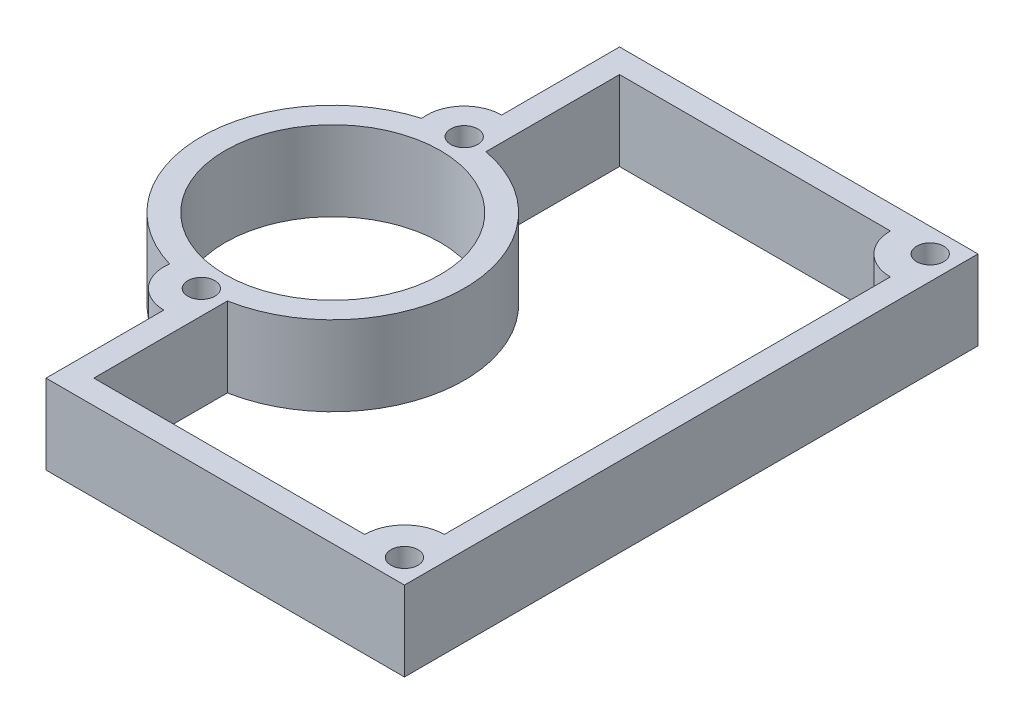
from build123d import *

# Parameters (mm, degrees)
SKETCH2_R           = 13.5
BOSS_EXTRUDE2_DEPTH = 10
CUT_EXTRUDE1_DEPTH  = 59.489315264
BOSS_EXTRUDE3_DEPTH = 10
SKETCH5_R           = 1.7
CUT_EXTRUDE3_DEPTH  = 59.489315264


with BuildPart() as part:
    # Sketch2 → Boss-Extrude2 (new body)
    # profile 1 of 4: a face of its own
    with BuildSketch(Plane(origin=(0, 0, 0), x_dir=(1, 0, 0), z_dir=(0, 1, 0))):
        with BuildLine():
            ThreePointArc((4.652086817, 15.830606061), (3.552193091, 19.577649142), (0, 21.2))
            ThreePointArc((0, 21.2), (-3.552193091, 19.577649142), (-4.652086817, 15.830606061))
            ThreePointArc((-4.652086817, 15.830606061), (-3.188214551, 16.189048396), (-1.697742762, 16.412424242))
            ThreePointArc((-1.697742762, 16.412424242), (-0.043802421, 18.199435597), (1.7, 16.5))
            ThreePointArc((1.7, 16.5), (1.699435597, 16.456197579), (1.697742762, 16.412424242))
            ThreePointArc((1.697742762, 16.412424242), (3.188214551, 16.189048396), (4.652086817, 15.830606061))
        make_face()
    # profile 2 of 4: a face of its own
    with BuildSketch(Plane(origin=(0, 0, 0), x_dir=(1, 0, 0), z_dir=(0, 1, 0))):
        with BuildLine():
            ThreePointArc((-1.697742762, 16.412424242), (-3.188214551, 16.189048396), (-4.652086817, 15.830606061))
            ThreePointArc((-4.652086817, 15.830606061), (-16.5, 0), (-4.652086817, -15.830606061))
            ThreePointArc((-4.652086817, -15.830606061), (-3.188214551, -16.189048396), (-1.697742762, -16.412424242))
            ThreePointArc((-1.697742762, -16.412424242), (0, -14.8), (1.697742762, -16.412424242))
            ThreePointArc((1.697742762, -16.412424242), (3.188214551, -16.189048396), (4.652086817, -15.830606061))
            ThreePointArc((4.652086817, -15.830606061), (16.5, 0), (4.652086817, 15.830606061))
            ThreePointArc((4.652086817, 15.830606061), (3.188214551, 16.189048396), (1.697742762, 16.412424242))
            ThreePointArc((1.697742762, 16.412424242), (0, 14.8), (-1.697742762, 16.412424242))
        make_face()
        with Locations(Location((0, 0, 0), (0, 0, 270))):
            Circle(SKETCH2_R, mode=Mode.SUBTRACT)
    # profile 3 of 4: a face of its own
    with BuildSketch(Plane(origin=(0, 0, 0), x_dir=(1, 0, 0), z_dir=(0, 1, 0))):
        with BuildLine():
            ThreePointArc((-1.697742762, -16.412424242), (-3.188214551, -16.189048396), (-4.652086817, -15.830606061))
            ThreePointArc((-4.652086817, -15.830606061), (-3.552193091, -19.577649142), (0, -21.2))
            ThreePointArc((0, -21.2), (3.552193091, -19.577649142), (4.652086817, -15.830606061))
            ThreePointArc((4.652086817, -15.830606061), (3.188214551, -16.189048396), (1.697742762, -16.412424242))
            ThreePointArc((1.697742762, -16.412424242), (1.699435597, -16.456197579), (1.7, -16.5))
            ThreePointArc((1.7, -16.5), (-0.043802421, -18.199435597), (-1.697742762, -16.412424242))
        make_face()
    # profile 4 of 4: a face of its own
    with BuildSketch(Plane(origin=(0, 0, 0), x_dir=(1, 0, 0), z_dir=(0, 1, 0))):
        with BuildLine():
            Line((0, 36), (0, 21.2))
            ThreePointArc((0, 21.2), (3.552193091, 19.577649142), (4.652086817, 15.830606061))
            ThreePointArc((4.652086817, 15.830606061), (16.5, 0), (4.652086817, -15.830606061))
            ThreePointArc((4.652086817, -15.830606061), (3.552193091, -19.577649142), (0, -21.2))
            Line((0, -21.2), (0, -36))
            Line((0, -36), (45, -36))
            Line((45, -36), (45, 36))
            Line((45, 36), (0, 36))
        make_face()
    extrude(amount=BOSS_EXTRUDE2_DEPTH)

    # Sketch3 → Cut-Extrude1 (cut, through all)
    with BuildSketch(Plane(origin=(0, 10, 0), x_dir=(1, 0, 0), z_dir=(0, 1, 0))):
        with BuildLine():
            Line((3, 16.22498074), (3, 33))
            Line((3, 33), (42, 33))
            Line((42, 33), (42, -33))
            Line((42, -33), (3, -33))
            Line((3, -33), (3, -16.22498074))
            ThreePointArc((3, -16.22498074), (16.5, 0), (3, 16.22498074))
        make_face()
    extrude(amount=-CUT_EXTRUDE1_DEPTH, mode=Mode.SUBTRACT)

    # Sketch4 → Boss-Extrude3 (add, through all)
    with BuildSketch(Plane(origin=(0, 10, 0), x_dir=(1, 0, 0), z_dir=(0, 1, 0))):
        with BuildLine():
            Line((37, -33), (42, -33))
            Line((42, -33), (42, -28))
            ThreePointArc((42, -28), (38.464466094, -29.464466094), (37, -33))
        make_face()
        with BuildLine():
            Line((37, 33), (42, 33))
            Line((42, 33), (42, 28))
            ThreePointArc((42, 28), (38.464466094, 29.464466094), (37, 33))
        make_face()
    extrude(amount=-BOSS_EXTRUDE3_DEPTH)

    # Sketch5 → Cut-Extrude3 (cut, through all)
    with BuildSketch(Plane(origin=(0, 10, 0), x_dir=(1, 0, 0), z_dir=(0, 1, 0))):
        with Locations(Location((42, 33, 0), (0, 0, 270))):
            Circle(SKETCH5_R)
        with Locations(Location((42, -33, 0), (0, 0, 270))):
            Circle(SKETCH5_R)
    extrude(amount=-CUT_EXTRUDE3_DEPTH, mode=Mode.SUBTRACT)


solid = part.part
